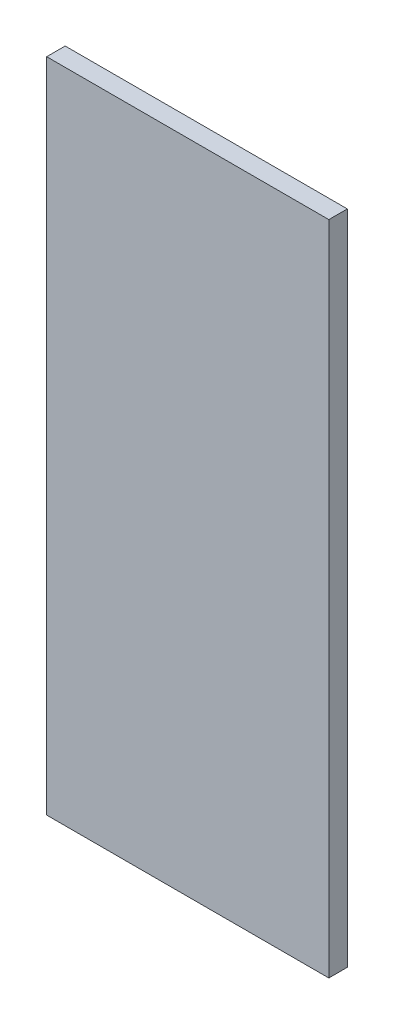
from build123d import *

# Parameters (mm, degrees)
CROQUIS1_W              = 61
CROQUIS1_H              = 142
SALIENTE_EXTRUIR1_DEPTH = 4


with BuildPart() as part:
    # Croquis1 → Saliente-Extruir1 (new body)
    with BuildSketch(Plane.XY):
        with Locations((30.5, 71)):
            Rectangle(CROQUIS1_W, CROQUIS1_H)
    extrude(amount=SALIENTE_EXTRUIR1_DEPTH)


solid = part.part
